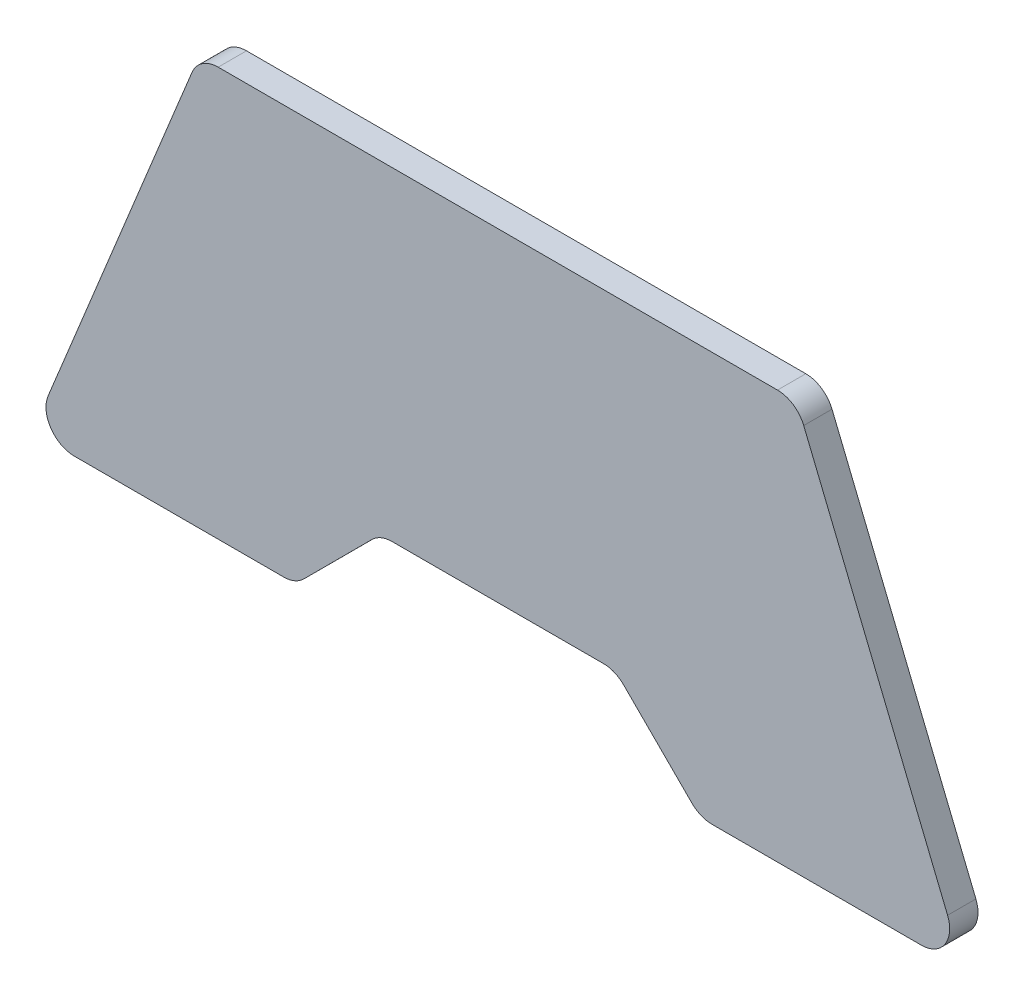
from build123d import *

# Parameters (mm, degrees)
BOSS_EXTRU_1_DEPTH = 5


with BuildPart() as part:
    # Esquisse1 → Boss.-Extru.1 (new body)
    with BuildSketch(Plane.XY):
        with BuildLine():
            Line((18.678931953, 0), (-18.678931953, 0))
            ThreePointArc((-18.678931953, 0), (-20.593787959, -0.381198589), (-22.216667802, -1.466669409))
            Line((-22.216667802, -1.466669409), (-34.268303338, -13.533330591))
            ThreePointArc((-34.268303338, -13.533330591), (-35.891183181, -14.618801411), (-37.806039187, -15))
            Line((-37.806039187, -15), (-74.7891965, -15))
            ThreePointArc((-74.7891965, -15), (-78.939806813, -12.787908541), (-79.417805276, -8.108973613))
            Line((-79.417805276, -8.108973613), (-54.003311504, 54.097323294))
            ThreePointArc((-54.003311504, 54.097323294), (-52.162611268, 56.35690722), (-49.374702728, 57.206296907))
            Line((-49.374702728, 57.206296907), (49.408433171, 57.206296907))
            ThreePointArc((49.408433171, 57.206296907), (52.196341712, 56.35690722), (54.037041947, 54.097323294))
            Line((54.037041947, 54.097323294), (79.45153572, -8.108973613))
            ThreePointArc((79.45153572, -8.108973613), (78.973537256, -12.787908541), (74.822926944, -15))
            Line((74.822926944, -15), (37.836120195, -15))
            ThreePointArc((37.836120195, -15), (35.924142063, -14.619993466), (34.302789604, -13.537735849))
            Line((34.302789604, -13.537735849), (22.212262543, -1.462264151))
            ThreePointArc((22.212262543, -1.462264151), (20.590910085, -0.380006534), (18.678931953, 0))
        make_face()
    extrude(amount=BOSS_EXTRU_1_DEPTH)


solid = part.part
